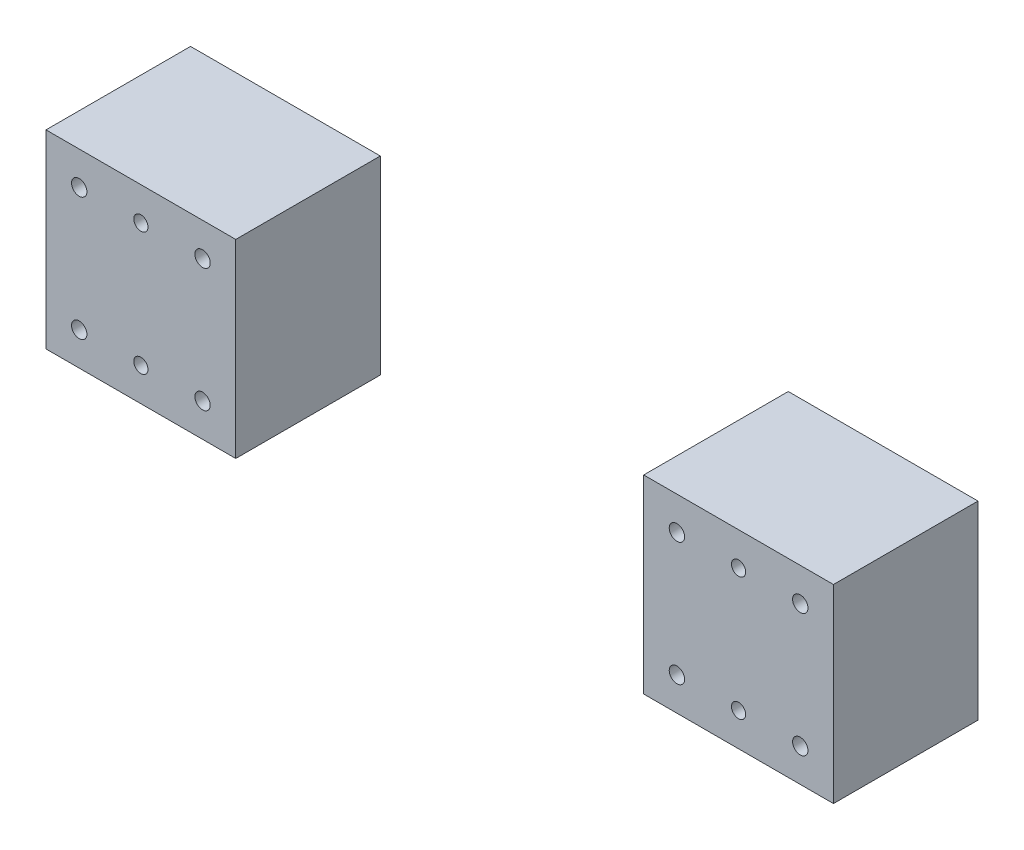
from build123d import *

# Parameters (mm, degrees)
SKETCH1_W             = 40
SKETCH1_H             = 40
SKETCH1_R             = 1.621
BOSS_EXTRUDE1_DEPTH   = 30.47
BOSS_EXTRUDE1_2_DEPTH = 30.47
SKETCH4_R             = 4.2
CUT_EXTRUDE1_DEPTH    = 20
SKETCH5_R             = 1.5
CUT_EXTRUDE2_DEPTH    = 174.448611698


with BuildPart() as part:
    # Sketch1 → Boss-Extrude1 (new body)
    with BuildSketch(Plane(origin=(0, 0, 0), x_dir=(-1, 0, 0), z_dir=(0, 0, 1))):
        with Locations((-20, -20)):
            Rectangle(SKETCH1_W, SKETCH1_H)
        with Locations((-33, -7)):
            Circle(SKETCH1_R, mode=Mode.SUBTRACT)
        with Locations((-7, -7)):
            Circle(SKETCH1_R, mode=Mode.SUBTRACT)
        with Locations((-7, -33)):
            Circle(SKETCH1_R, mode=Mode.SUBTRACT)
        with Locations((-33, -33)):
            Circle(SKETCH1_R, mode=Mode.SUBTRACT)
    extrude(amount=BOSS_EXTRUDE1_DEPTH)


with BuildPart() as body_2:
    # Sketch1 → Boss-Extrude1 2 (new body)
    with BuildSketch(Plane(origin=(0, 0, 0), x_dir=(-1, 0, 0), z_dir=(0, 0, 1))):
        with Locations((-146, -20)):
            Rectangle(SKETCH1_W, SKETCH1_H)
        with Locations((-159, -7)):
            Circle(SKETCH1_R, mode=Mode.SUBTRACT)
        with Locations((-133, -7)):
            Circle(SKETCH1_R, mode=Mode.SUBTRACT)
        with Locations((-133, -33)):
            Circle(SKETCH1_R, mode=Mode.SUBTRACT)
        with Locations((-159, -33)):
            Circle(SKETCH1_R, mode=Mode.SUBTRACT)
    extrude(amount=BOSS_EXTRUDE1_2_DEPTH)


with BuildPart() as cut_extrude1_tool:
    # Sketch4 → Cut-Extrude1 (new body)
    with BuildSketch(Plane(origin=(0, 0, 0), x_dir=(-1, 0, 0), z_dir=(0, 0, -1))):
        with Locations((-7, 7)):
            Circle(SKETCH4_R)
        with Locations((-33, 7)):
            Circle(SKETCH4_R)
        with Locations((-7, 33)):
            Circle(SKETCH4_R)
        with Locations((-33, 33)):
            Circle(SKETCH4_R)
        with Locations((-133, 7)):
            Circle(SKETCH4_R)
        with Locations((-133, 33)):
            Circle(SKETCH4_R)
        with Locations((-159, 33)):
            Circle(SKETCH4_R)
        with Locations((-159, 7)):
            Circle(SKETCH4_R)
    extrude(amount=-CUT_EXTRUDE1_DEPTH)


with BuildPart() as part_1:
    add(part.part)

    # Cut-Extrude1: cut by cut_extrude1_tool
    add(cut_extrude1_tool.part, mode=Mode.SUBTRACT)


with BuildPart() as body_2_1:
    add(body_2.part)

    # Cut-Extrude1: cut by cut_extrude1_tool
    add(cut_extrude1_tool.part, mode=Mode.SUBTRACT)


with BuildPart() as cut_extrude2_tool:
    # Sketch5 → Cut-Extrude2 (new, through all)
    with BuildSketch(Plane(origin=(0, 0, 0), x_dir=(-1, 0, 0), z_dir=(0, 0, -1))):
        with Locations((-20, 7)):
            Circle(SKETCH5_R)
        with Locations((-20, 33)):
            Circle(SKETCH5_R)
        with Locations((-146, 7)):
            Circle(SKETCH5_R)
        with Locations((-146, 33)):
            Circle(SKETCH5_R)
    extrude(amount=-CUT_EXTRUDE2_DEPTH)


with BuildPart() as part_2:
    add(part_1.part)

    # Cut-Extrude2: cut by cut_extrude2_tool
    add(cut_extrude2_tool.part, mode=Mode.SUBTRACT)


with BuildPart() as body_2_2:
    add(body_2_1.part)

    # Cut-Extrude2: cut by cut_extrude2_tool
    add(cut_extrude2_tool.part, mode=Mode.SUBTRACT)


solid = Compound([part_2.part, body_2_2.part])
